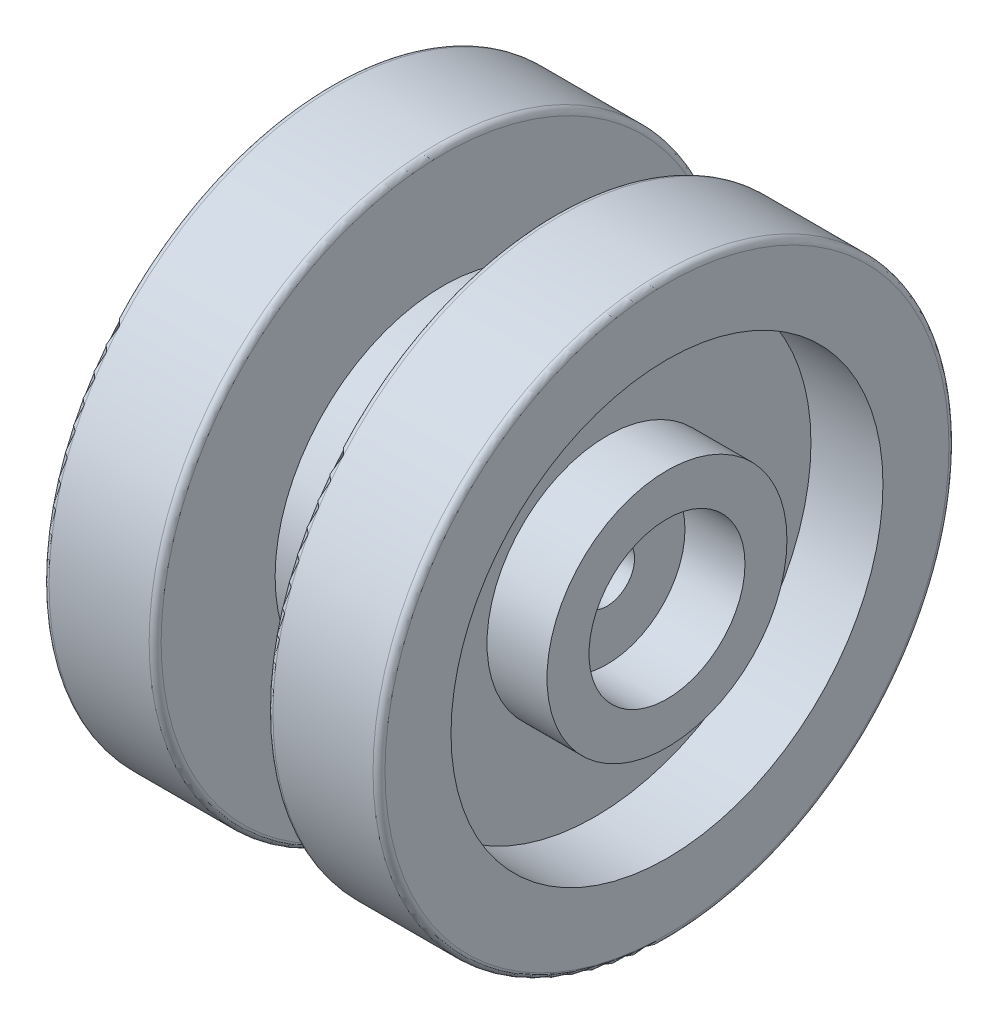
from build123d import *

# Parameters (mm, degrees)
SKETCH3_R           = 2
CUT_EXTRUDE1_DEPTH  = 57.257554101
FILLET2_R           = 0.5
SKETCH4_R           = 18
SKETCH4_R_2         = 6
CUT_EXTRUDE2_DEPTH  = 6
CUT_EXTRUDE3_START  = -6
SKETCH5_R           = 18
CUT_EXTRUDE3_DEPTH  = 6
SKETCH6_R           = 10
BOSS_EXTRUDE1_DEPTH = 6
SKETCH8_R           = 8
BOSS_EXTRUDE2_DEPTH = 10
SKETCH10_R          = 6.5
CUT_EXTRUDE5_DEPTH  = 5
SKETCH11_R          = 10
BOSS_EXTRUDE3_DEPTH = 5
CUT_EXTRUDE6_START  = -5
SKETCH12_R          = 6.5
CUT_EXTRUDE6_DEPTH  = 5
SKETCH7_R           = 2.3
CUT_EXTRUDE8_DEPTH  = 57.257554219


with BuildPart() as part:
    # Sketch2 → Revolve1 (revolve)
    with BuildSketch(Plane.XY, mode=Mode.PRIVATE) as revolve1_sk:
        Polygon((-2.085200875, -4.484260538), (7.234799125, -4.484260538), (7.234799125, 5.515739462), (16.574799125, 5.515739462), (16.574799125, -18.484260538), (-11.425200875, -18.484260538), (-11.425200875, 5.515739462), (-2.085200875, 5.515739462), align=None)
    revolve(revolve1_sk.sketch.rotate(Axis((-11.425200875, -18.484260538, 0), (1, 0, 0)), 90), axis=Axis((-11.425200875, -18.484260538, 0), (1, 0, 0)))

    # Sketch3 → Cut-Extrude1 (cut, through all)
    with BuildSketch(Plane(origin=(16.574799125, 0, 0), x_dir=(0, 0, -1), z_dir=(1, 0, 0))):
        with Locations((0, -18.484260538)):
            Circle(SKETCH3_R)
    extrude(amount=-CUT_EXTRUDE1_DEPTH, mode=Mode.SUBTRACT)

    # Fillet2
    fillet2_edges = [part.edges().sort_by_distance(p)[0] for p in [
        (-2.085200875, -18.484260538, -24),
        (7.234799125, -18.484260538, -24),
        (16.574799125, -18.484260538, -24),
        (-11.425200875, -18.484260538, -24),
    ]]
    fillet(fillet2_edges, radius=FILLET2_R)

    # Sketch4 → Cut-Extrude2 (cut)
    with BuildSketch(Plane(origin=(16.574799125, 0, 0), x_dir=(0, 0, -1), z_dir=(1, 0, 0))):
        with Locations((0, -18.484260538)):
            Circle(SKETCH4_R)
        with Locations((0, -18.484260538)):
            Circle(SKETCH4_R_2, mode=Mode.SUBTRACT)
    extrude(amount=-CUT_EXTRUDE2_DEPTH, mode=Mode.SUBTRACT)

    # Sketch5 → Cut-Extrude3 (cut)
    with BuildSketch(Plane.ZY.offset(11.425200875).offset(CUT_EXTRUDE3_START)):
        with Locations(Location((0, -18.484260538, 0), (0, 0, 180))):
            Circle(SKETCH5_R)
    extrude(amount=CUT_EXTRUDE3_DEPTH, mode=Mode.SUBTRACT)

    # Sketch6 → Boss-Extrude1 (add, through all)
    with BuildSketch(Plane.ZY.offset(5.425200875)):
        with Locations((0, -18.484260538)):
            Circle(SKETCH6_R)
    extrude(amount=BOSS_EXTRUDE1_DEPTH)

    # Sketch8 → Boss-Extrude2 (add)
    with BuildSketch(Plane(origin=(16.574799125, 0, 0), x_dir=(0, 0, -1), z_dir=(1, 0, 0))):
        with Locations((0, -18.484260538)):
            Circle(SKETCH8_R)
    extrude(amount=-BOSS_EXTRUDE2_DEPTH)

    # Sketch10 → Cut-Extrude5 (cut)
    with BuildSketch(Plane.ZY.offset(11.425200875)):
        with Locations((0, -18.484260538)):
            Circle(SKETCH10_R)
    extrude(amount=-CUT_EXTRUDE5_DEPTH, mode=Mode.SUBTRACT)

    # Sketch11 → Boss-Extrude3 (add)
    with BuildSketch(Plane(origin=(16.574799125, 0, 0), x_dir=(0, 0, -1), z_dir=(1, 0, 0))):
        with Locations(Location((0, -18.484260538, 0), (0, 0, 180))):
            Circle(SKETCH11_R)
    extrude(amount=-BOSS_EXTRUDE3_DEPTH)

    # Sketch12 → Cut-Extrude6 (cut)
    with BuildSketch(Plane(origin=(16.574799125, 0, 0), x_dir=(0, 0, -1), z_dir=(1, 0, 0)).offset(CUT_EXTRUDE6_START)):
        with Locations(Location((0, -18.484260538, 0), (0, 0, 180))):
            Circle(SKETCH12_R)
    extrude(amount=CUT_EXTRUDE6_DEPTH, mode=Mode.SUBTRACT)

    # Sketch7 → Cut-Extrude8 (cut, through all)
    with BuildSketch(Plane.ZY.offset(11.425200875)):
        with Locations((0, -18.484260538)):
            Circle(SKETCH7_R)
    extrude(amount=-CUT_EXTRUDE8_DEPTH, mode=Mode.SUBTRACT)


solid = part.part
